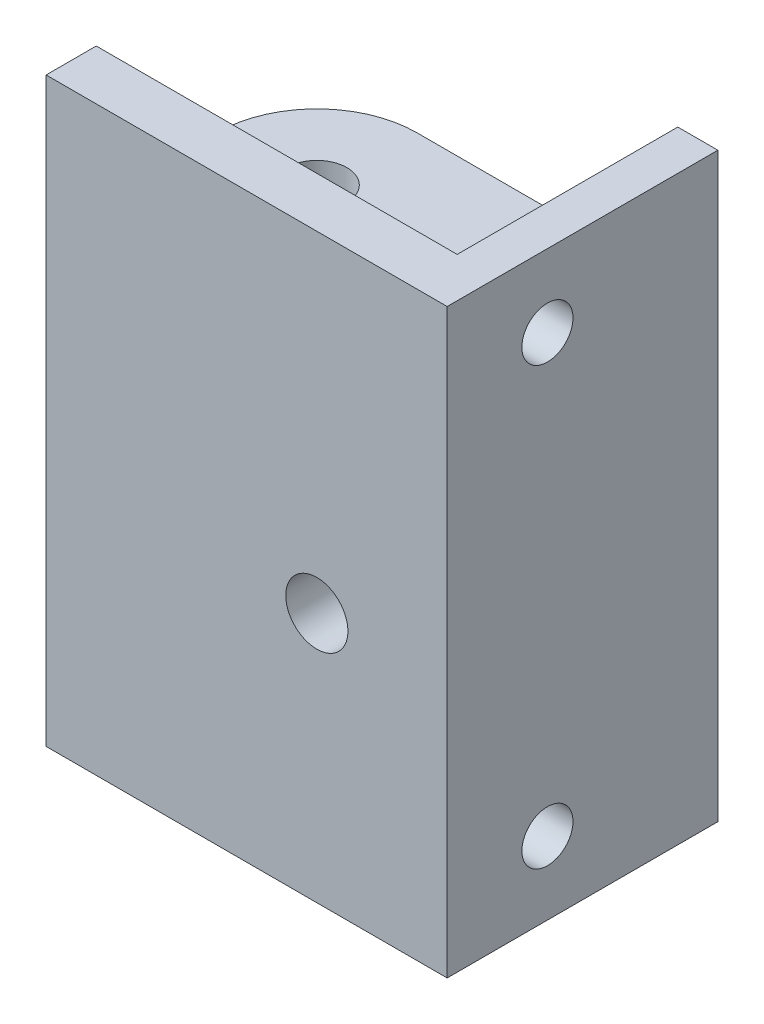
from build123d import *

# Parameters (mm, degrees)
EXTRUDE_1_DEPTH      = 58
SKETCH_2_R           = 3
CUT_EXTRUDE_1_DEPTH  = 58
SKETCH_3_W           = 15
SKETCH_3_H           = 14.5
SKETCH_3_W_2         = 25
CUT_EXTRUDE_2_DEPTH  = 22
SKETCH_5_W           = 4
SKETCH_5_H           = 14.5
EXTRUDE_2_DEPTH      = 22
CUT_EXTRUDE_3_DEPTH  = 22
CUT_EXTRUDE_START    = -30
CUT_EXTRUDE_4_DEPTH  = 30
EXTRUDE_START        = -4
EXTRUDE_5_DEPTH      = 4
EXTRUDE_6_DEPTH      = 4
SKETCH_18_R          = 3.05
CUT_EXTRUDE_7_DEPTH  = 50
SKETCH_17_R          = 1.51
CUT_EXTRUDE_8_DEPTH  = 50
EXTRUDE_7_DEPTH      = 4
EXTRUDE_START_2      = 1
SKETCH_20_R          = 1.51
EXTRUDE_8_DEPTH      = 1
SKETCH_21_R          = 3
SKETCH_21_R_2        = 1.51
CUT_EXTRUDE_9_DEPTH  = 2
EXTRUDE_9_DEPTH      = 4
SKETCH_23_R          = 1.51
EXTRUDE_10_DEPTH     = 1
CUT_EXTRUDE_START_2  = -2
SKETCH_24_R          = 3
CUT_EXTRUDE_10_DEPTH = 2
CUT_EXTRUDE_11_DEPTH = 100
SKETCH_26_R          = 3.05
EXTRUDE_11_DEPTH     = 27
SKETCH_27_R          = 3.1
CUT_EXTRUDE_12_DEPTH = 27
SKETCH_29_W          = 20
SKETCH_29_H          = 21
CUT_EXTRUDE_13_DEPTH = 20
EXTRUDE_START_3      = -5
SKETCH_30_R          = 3
EXTRUDE_12_DEPTH     = 5
SKETCH_32_R          = 3
EXTRUDE_13_DEPTH     = 5
SKETCH_34_R          = 1.51
CUT_EXTRUDE_14_DEPTH = 100
SKETCH_35_R          = 3
CUT_EXTRUDE_15_DEPTH = 2
SKETCH_36_R          = 3
CUT_EXTRUDE_16_DEPTH = 2
SKETCH_38_W          = 40
SKETCH_38_H          = 58
CUT_EXTRUDE_17_DEPTH = 50
EXTRUDE_START_4      = -1
SKETCH_40_R          = 1.51
EXTRUDE_14_DEPTH     = 1
CUT_EXTRUDE_START_3  = -1
SKETCH_41_R          = 3
CUT_EXTRUDE_18_DEPTH = 1
SKETCH_42_R          = 1.51
EXTRUDE_15_DEPTH     = 1
SKETCH_43_R          = 3
CUT_EXTRUDE_19_DEPTH = 1


with BuildPart() as part:
    # 草图1 → 凸台-拉伸1 (new body)
    with BuildSketch(Plane(origin=(0, 0, 0), x_dir=(1, 0, 0), z_dir=(0, 1, 0))):
        with BuildLine():
            Line((-20, 13.5), (5, 13.5))
            ThreePointArc((5, 13.5), (15.606601718, 9.106601718), (20, -1.5))
            Line((20, -1.5), (20, -13.5))
            Line((20, -13.5), (-20, -13.5))
            Line((-20, -13.5), (-20, 13.5))
        make_face()
    extrude_1 = extrude(amount=EXTRUDE_1_DEPTH)

    # 草图2 → 切除-拉伸1 (cut)
    with BuildSketch(Plane.XY.offset(13.5)):
        with Locations((-7, 33)):
            Circle(SKETCH_2_R)
    extrude(amount=-CUT_EXTRUDE_1_DEPTH, mode=Mode.SUBTRACT)

    # 草图3 → 切除-拉伸2 (cut)
    with BuildSketch(Plane(origin=(0, 0, -13.5), x_dir=(-1, 0, 0), z_dir=(0, 0, -1))):
        with Locations((-12.5, 50.75)):
            Rectangle(SKETCH_3_W, SKETCH_3_H)
        with Locations((-12.5, 7.25)):
            Rectangle(SKETCH_3_W, SKETCH_3_H)
        with Locations((7.5, 7.25)):
            Rectangle(SKETCH_3_W_2, SKETCH_3_H)
        with Locations((7.5, 50.75)):
            Rectangle(SKETCH_3_W_2, SKETCH_3_H)
    cut_extrude_2 = extrude(amount=-CUT_EXTRUDE_2_DEPTH, mode=Mode.SUBTRACT)

    # 草图5 → 凸台-拉伸2 (add)
    with BuildSketch(Plane(origin=(0, 0, 8.5), x_dir=(-1, 0, 0), z_dir=(0, 0, -1))):
        with Locations((18, 7.25)):
            Rectangle(SKETCH_5_W, SKETCH_5_H)
        with Locations((18, 50.75)):
            Rectangle(SKETCH_5_W, SKETCH_5_H)
    extrude_2 = extrude(amount=EXTRUDE_2_DEPTH)

    # 草图8 → 切除-拉伸3 (cut)
    with BuildSketch(Plane.ZY.offset(20)):
        with BuildLine():
            ThreePointArc((6.05, 50.75), (5.303122292, 52.553122292), (3.5, 53.3))
            Line((3.5, 53.3), (3.5, 48.2))
            ThreePointArc((3.5, 48.2), (5.303122292, 48.946877708), (6.05, 50.75))
        make_face()
        with BuildLine():
            Line((3.5, 48.2), (3.5, 53.3))
            ThreePointArc((3.5, 53.3), (0.95, 50.75), (3.5, 48.2))
        make_face()
        with BuildLine():
            ThreePointArc((3.5, 9.8), (0.95, 7.25), (3.5, 4.7))
            Line((3.5, 4.7), (3.5, 9.8))
        make_face()
        with BuildLine():
            Line((3.5, 9.8), (3.5, 4.7))
            ThreePointArc((3.5, 4.7), (5.303122292, 5.446877708), (6.05, 7.25))
            ThreePointArc((6.05, 7.25), (5.303122292, 9.053122292), (3.5, 9.8))
        make_face()
    cut_extrude_3 = extrude(amount=-CUT_EXTRUDE_3_DEPTH, mode=Mode.SUBTRACT)

    # 草图10 → 切除-拉伸4 (cut)
    with BuildSketch(Plane(origin=(0, 43.5, 0), x_dir=(1, 0, 0), z_dir=(0, 1, 0)).offset(CUT_EXTRUDE_START)):
        with BuildLine():
            Line((20, -6.5), (20, -1.5))
            ThreePointArc((20, -1.5), (15.606601718, 9.106601718), (5, 13.5))
            Line((5, 13.5), (0, 13.5))
            ThreePointArc((0, 13.5), (5.857864376, -0.642135624), (20, -6.5))
        make_face()
        with BuildLine():
            Line((20, -1.5), (20, 13.5))
            Line((20, 13.5), (5, 13.5))
            ThreePointArc((5, 13.5), (15.606601718, 9.106601718), (20, -1.5))
        make_face()
    extrude(amount=CUT_EXTRUDE_4_DEPTH, mode=Mode.SUBTRACT)

    # 草图11 → 凸台-拉伸5 (add)
    with BuildSketch(Plane(origin=(0, 43.5, 0), x_dir=(1, 0, 0), z_dir=(0, 1, 0)).offset(EXTRUDE_START)):
        with BuildLine():
            Line((5, 13.5), (0, 13.5))
            ThreePointArc((0, 13.5), (5.857864376, -0.642135624), (20, -6.5))
            Line((20, -6.5), (20, -1.5))
            ThreePointArc((20, -1.5), (15.606601718, 9.106601718), (5, 13.5))
        make_face()
    extrude_5 = extrude(amount=EXTRUDE_5_DEPTH)

    # 草图13 → 凸台-拉伸6 (add)
    with BuildSketch(Plane.XZ.offset(-14.5)):
        with BuildLine():
            Line((0, -13.5), (5, -13.5))
            ThreePointArc((5, -13.5), (15.606601718, -9.106601718), (20, 1.5))
            Line((20, 1.5), (20, 6.5))
            ThreePointArc((20, 6.5), (5.857864376, 0.642135624), (0, -13.5))
        make_face()
    extrude_6 = extrude(amount=-EXTRUDE_6_DEPTH)

    # 草图18 → 切除-拉伸7 (cut)
    with BuildSketch(Plane.XY.offset(13.5)):
        with Locations((-7, 33)):
            Circle(SKETCH_18_R)
    extrude(amount=-CUT_EXTRUDE_7_DEPTH, mode=Mode.SUBTRACT)

    # 草图17 → 切除-拉伸8 (cut)
    with BuildSketch(Plane(origin=(0, 43.5, 0), x_dir=(1, 0, 0), z_dir=(0, 1, 0))):
        with Locations(Location((12.928932188, 6.428932188, 0), (0, 0, 270))):
            Circle(SKETCH_17_R)
    extrude(amount=-CUT_EXTRUDE_8_DEPTH, mode=Mode.SUBTRACT)

    # 草图19 → 凸台-拉伸7 (add)
    with BuildSketch(Plane(origin=(0, 43.5, 0), x_dir=(1, 0, 0), z_dir=(0, 1, 0)).offset(EXTRUDE_START)):
        with BuildLine():
            Line((10, 13.5), (5, 13.5))
            ThreePointArc((5, 13.5), (15.606601718, 9.106601718), (20, -1.5))
            Line((20, -1.5), (20, 3.5))
            ThreePointArc((20, 3.5), (17.071067812, 10.571067812), (10, 13.5))
        make_face()
    extrude_7 = extrude(amount=EXTRUDE_7_DEPTH)

    # 草图20 → 凸台-拉伸8 (add)
    with BuildSketch(Plane(origin=(0, 43.5, 0), x_dir=(1, 0, 0), z_dir=(0, 1, 0)).offset(EXTRUDE_START_2)):
        with BuildLine():
            Line((20, 3.5), (20, -8.5))
            Line((20, -8.5), (-16, -8.5))
            Line((-16, -8.5), (-16, 13.5))
            Line((-16, 13.5), (10, 13.5))
            ThreePointArc((10, 13.5), (17.071067812, 10.571067812), (20, 3.5))
        make_face()
        with Locations(Location((12.928932188, 6.428932188, 0), (0, 0, 270))):
            Circle(SKETCH_20_R, mode=Mode.SUBTRACT)
    extrude_8 = extrude(amount=-EXTRUDE_8_DEPTH)

    # 草图21 → 切除-拉伸9 (cut)
    with BuildSketch(Plane(origin=(0, 44.5, 0), x_dir=(1, 0, 0), z_dir=(0, 1, 0))):
        with Locations(Location((12.928932188, 6.428932188, 0), (0, 0, 270))):
            Circle(SKETCH_21_R)
        with Locations(Location((12.928932188, 6.428932188, 0), (0, 0, 270))):
            Circle(SKETCH_21_R_2, mode=Mode.SUBTRACT)
    extrude(amount=-CUT_EXTRUDE_9_DEPTH, mode=Mode.SUBTRACT)

    # 草图22 → 凸台-拉伸9 (add)
    with BuildSketch(Plane(origin=(0, 14.5, 0), x_dir=(-1, 0, 0), z_dir=(0, -1, 0))):
        with BuildLine():
            Line((-5, 13.5), (-10, 13.5))
            ThreePointArc((-10, 13.5), (-17.071067812, 10.571067812), (-20, 3.5))
            Line((-20, 3.5), (-20, -1.5))
            ThreePointArc((-20, -1.5), (-15.606601718, 9.106601718), (-5, 13.5))
        make_face()
    extrude_9 = extrude(amount=-EXTRUDE_9_DEPTH)

    # 草图23 → 凸台-拉伸10 (add)
    with BuildSketch(Plane(origin=(0, 14.5, 0), x_dir=(-1, 0, 0), z_dir=(0, -1, 0))):
        with BuildLine():
            Line((16, -8.5), (16, 13.5))
            Line((16, 13.5), (-10, 13.5))
            ThreePointArc((-10, 13.5), (-17.071067812, 10.571067812), (-20, 3.5))
            Line((-20, 3.5), (-20, -8.5))
            Line((-20, -8.5), (16, -8.5))
        make_face()
        with Locations(Location((-12.928932188, 6.428932188, 0), (0, 0, 270))):
            Circle(SKETCH_23_R, mode=Mode.SUBTRACT)
    extrude_10 = extrude(amount=EXTRUDE_10_DEPTH)

    # 草图24 → 切除-拉伸10 (cut)
    with BuildSketch(Plane(origin=(0, 13.5, 0), x_dir=(-1, 0, 0), z_dir=(0, -1, 0)).offset(CUT_EXTRUDE_START_2)):
        with Locations(Location((-12.928932188, 6.428932188, 0), (0, 0, 270))):
            Circle(SKETCH_24_R)
    extrude(amount=CUT_EXTRUDE_10_DEPTH, mode=Mode.SUBTRACT)

    # 草图25 → 切除-拉伸11 (cut)
    with BuildSketch(Plane.XY.offset(13.5)):
        with BuildLine():
            ThreePointArc((-3.95, 25), (-4.843324317, 27.156675683), (-7, 28.05))
            Line((-7, 28.05), (-7, 21.95))
            ThreePointArc((-7, 21.95), (-4.843324317, 22.843324317), (-3.95, 25))
        make_face()
        with BuildLine():
            Line((-7, 21.95), (-7, 28.05))
            ThreePointArc((-7, 28.05), (-10.05, 25), (-7, 21.95))
        make_face()
    extrude(amount=-CUT_EXTRUDE_11_DEPTH, mode=Mode.SUBTRACT)

    # 草图26 → 凸台-拉伸11 (add)
    with BuildSketch(Plane.XY.offset(13.5)):
        with Locations((-7, 33)):
            Circle(SKETCH_26_R)
    extrude(amount=-EXTRUDE_11_DEPTH)

    # 草图27 → 切除-拉伸12 (cut)
    with BuildSketch(Plane.XY.offset(13.5)):
        with Locations((-7, 25)):
            Circle(SKETCH_27_R)
    cut_extrude_12 = extrude(amount=-CUT_EXTRUDE_12_DEPTH, mode=Mode.SUBTRACT)

    # 草图29 → 切除-拉伸13 (cut)
    with BuildSketch(Plane(origin=(0, 0, -13.5), x_dir=(-1, 0, 0), z_dir=(0, 0, -1))):
        with Locations((-10, 29)):
            Rectangle(SKETCH_29_W, SKETCH_29_H)
    cut_extrude_13 = extrude(amount=-CUT_EXTRUDE_13_DEPTH, mode=Mode.SUBTRACT)

    # 草图30 → 凸台-拉伸12 (add)
    with BuildSketch(Plane(origin=(0, 13.5, 0), x_dir=(-1, 0, 0), z_dir=(0, -1, 0)).offset(EXTRUDE_START_3)):
        with Locations(Location((-12.928932188, 6.428932188, 0), (0, 0, 270))):
            Circle(SKETCH_30_R)
    extrude(amount=EXTRUDE_12_DEPTH)

    # 草图32 → 凸台-拉伸13 (add)
    with BuildSketch(Plane(origin=(0, 44.5, 0), x_dir=(1, 0, 0), z_dir=(0, 1, 0))):
        with Locations((12.928932188, 6.428932188)):
            Circle(SKETCH_32_R)
    extrude(amount=-EXTRUDE_13_DEPTH)

    # 草图34 → 切除-拉伸14 (cut)
    with BuildSketch(Plane(origin=(0, 44.5, 0), x_dir=(1, 0, 0), z_dir=(0, 1, 0))):
        with Locations(Location((10.5, 4, 0), (0, 0, 270))):
            Circle(SKETCH_34_R)
    cut_extrude_14 = extrude(amount=-CUT_EXTRUDE_14_DEPTH, mode=Mode.SUBTRACT)

    # 草图35 → 切除-拉伸15 (cut)
    with BuildSketch(Plane(origin=(0, 44.5, 0), x_dir=(1, 0, 0), z_dir=(0, 1, 0))):
        with Locations(Location((10.5, 4, 0), (0, 0, 270))):
            Circle(SKETCH_35_R)
    cut_extrude_15 = extrude(amount=-CUT_EXTRUDE_15_DEPTH, mode=Mode.SUBTRACT)

    # 草图36 → 切除-拉伸16 (cut)
    with BuildSketch(Plane(origin=(0, 13.5, 0), x_dir=(-1, 0, 0), z_dir=(0, -1, 0)).offset(CUT_EXTRUDE_START_2)):
        with Locations(Location((-10.5, 4, 0), (0, 0, 270))):
            Circle(SKETCH_36_R)
    cut_extrude_16 = extrude(amount=CUT_EXTRUDE_16_DEPTH, mode=Mode.SUBTRACT)

    # 镜向1: 凸台-拉伸1, 切除-拉伸2, 凸台-拉伸2, 切除-拉伸3, 凸台-拉伸5, 凸台-拉伸6, 凸台-拉伸7, 凸台-拉伸8, 凸台-拉伸9, 凸台-拉伸10, 切除-拉伸12, 切除-拉伸13, 切除-拉伸14, 切除-拉伸15, 切除-拉伸16 across plane
    add(extrude_1.mirror(Plane(origin=(-20, 58, 13.5), x_dir=(0, 0, 1), z_dir=(-1, 0, 0))))
    add(cut_extrude_2.mirror(Plane(origin=(-20, 58, 13.5), x_dir=(0, 0, 1), z_dir=(-1, 0, 0))), mode=Mode.SUBTRACT)
    add(extrude_2.mirror(Plane(origin=(-20, 58, 13.5), x_dir=(0, 0, 1), z_dir=(-1, 0, 0))))
    add(cut_extrude_3.mirror(Plane(origin=(-20, 58, 13.5), x_dir=(0, 0, 1), z_dir=(-1, 0, 0))), mode=Mode.SUBTRACT)
    add(extrude_5.mirror(Plane(origin=(-20, 58, 13.5), x_dir=(0, 0, 1), z_dir=(-1, 0, 0))))
    add(extrude_6.mirror(Plane(origin=(-20, 58, 13.5), x_dir=(0, 0, 1), z_dir=(-1, 0, 0))))
    add(extrude_7.mirror(Plane(origin=(-20, 58, 13.5), x_dir=(0, 0, 1), z_dir=(-1, 0, 0))))
    add(extrude_8.mirror(Plane(origin=(-20, 58, 13.5), x_dir=(0, 0, 1), z_dir=(-1, 0, 0))))
    add(extrude_9.mirror(Plane(origin=(-20, 58, 13.5), x_dir=(0, 0, 1), z_dir=(-1, 0, 0))))
    add(extrude_10.mirror(Plane(origin=(-20, 58, 13.5), x_dir=(0, 0, 1), z_dir=(-1, 0, 0))))
    add(cut_extrude_12.mirror(Plane(origin=(-20, 58, 13.5), x_dir=(0, 0, 1), z_dir=(-1, 0, 0))), mode=Mode.SUBTRACT)
    add(cut_extrude_13.mirror(Plane(origin=(-20, 58, 13.5), x_dir=(0, 0, 1), z_dir=(-1, 0, 0))), mode=Mode.SUBTRACT)
    add(cut_extrude_14.mirror(Plane(origin=(-20, 58, 13.5), x_dir=(0, 0, 1), z_dir=(-1, 0, 0))), mode=Mode.SUBTRACT)
    add(cut_extrude_15.mirror(Plane(origin=(-20, 58, 13.5), x_dir=(0, 0, 1), z_dir=(-1, 0, 0))), mode=Mode.SUBTRACT)
    add(cut_extrude_16.mirror(Plane(origin=(-20, 58, 13.5), x_dir=(0, 0, 1), z_dir=(-1, 0, 0))), mode=Mode.SUBTRACT)

    # 草图38 → 切除-拉伸17 (cut)
    with BuildSketch(Plane(origin=(0, 0, -13.5), x_dir=(-1, 0, 0), z_dir=(0, 0, -1))):
        with Locations((0, 29)):
            Rectangle(SKETCH_38_W, SKETCH_38_H)
    extrude(amount=-CUT_EXTRUDE_17_DEPTH, mode=Mode.SUBTRACT)

    # 草图40 → 凸台-拉伸14 (add)
    with BuildSketch(Plane(origin=(0, 13.5, 0), x_dir=(-1, 0, 0), z_dir=(0, -1, 0)).offset(EXTRUDE_START_4)):
        with Locations((52.928932188, 6.428932188)):
            Circle(SKETCH_40_R)
    extrude(amount=EXTRUDE_14_DEPTH)

    # 草图41 → 切除-拉伸18 (cut)
    with BuildSketch(Plane(origin=(0, 13.5, 0), x_dir=(-1, 0, 0), z_dir=(0, -1, 0)).offset(CUT_EXTRUDE_START_3)):
        with Locations(Location((50.5, 4, 0), (0, 0, 270))):
            Circle(SKETCH_41_R)
    extrude(amount=CUT_EXTRUDE_18_DEPTH, mode=Mode.SUBTRACT)

    # 草图42 → 凸台-拉伸15 (add)
    with BuildSketch(Plane(origin=(0, 44.5, 0), x_dir=(1, 0, 0), z_dir=(0, 1, 0))):
        with Locations((-52.928932188, 6.428932188)):
            Circle(SKETCH_42_R)
    extrude(amount=-EXTRUDE_15_DEPTH)

    # 草图43 → 切除-拉伸19 (cut)
    with BuildSketch(Plane(origin=(0, 44.5, 0), x_dir=(1, 0, 0), z_dir=(0, 1, 0))):
        with Locations(Location((-50.5, 4, 0), (0, 0, 270))):
            Circle(SKETCH_43_R)
    extrude(amount=-CUT_EXTRUDE_19_DEPTH, mode=Mode.SUBTRACT)


solid = part.part
